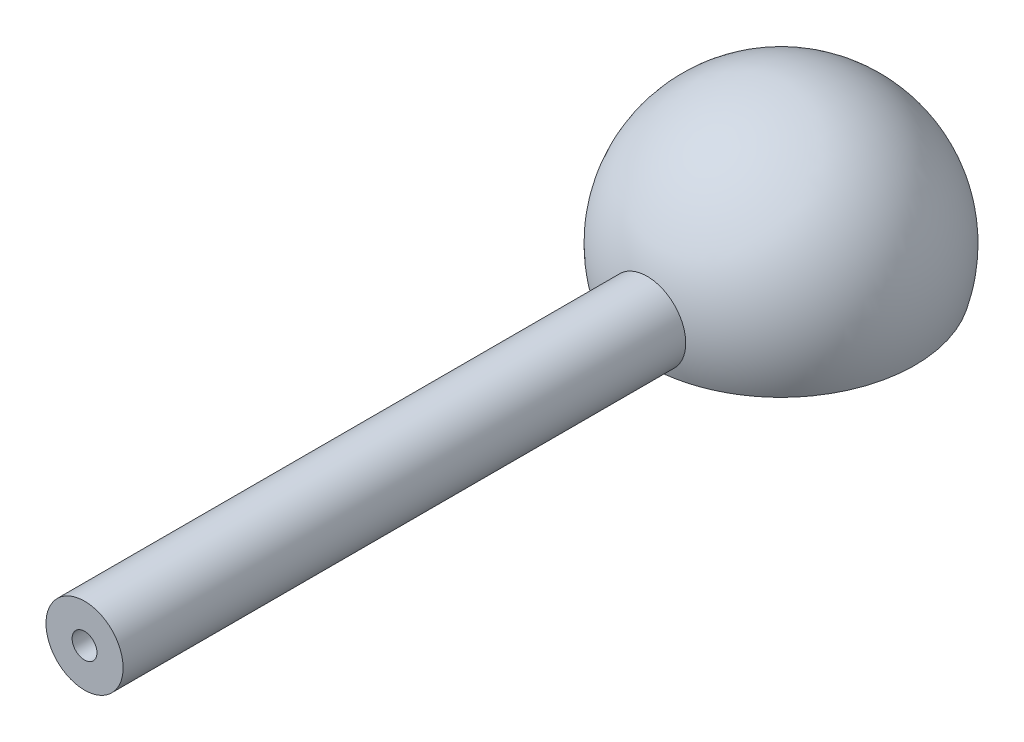
from build123d import *

# Parameters (mm, degrees)
CROQUIS2_R                 = 9
SALIENTE_EXTRUIR1_DEPTH    = 130
CROQUIS4_R                 = 2.9
CORTAR_EXTRUIR1_DEPTH      = 110
CROQUIS8_R                 = 30
CORTAR_EXTRUIR4_DEPTH      = 50
CORTAR_EXTRUIR5_DEPTH      = 50
CORTAR_EXTRUIR5_DEPTH_BACK = 50
CROQUIS9_W                 = 68.768977454
CROQUIS9_H                 = 16.045857594


with BuildPart() as part:
    # Croquis2 → Saliente-Extruir1 (new body)
    with BuildSketch(Plane.XY):
        Circle(CROQUIS2_R)
    extrude(amount=SALIENTE_EXTRUIR1_DEPTH)

    # Croquis4 → Cortar-Extruir1 (cut)
    with BuildSketch(Plane.XY.offset(130)):
        Circle(CROQUIS4_R)
    extrude(amount=-CORTAR_EXTRUIR1_DEPTH, mode=Mode.SUBTRACT)

    # Croquis5 → Revolución1 (revolve)
    with BuildSketch(Plane(origin=(0, 0, 0), x_dir=(1, 0, 0), z_dir=(0, 1, 0))):
        with BuildLine():
            Line((-9, 0), (-9, 1.271007061))
            add(Edge.make_bspline(
                [(0, 65), (-28.23274128, 65), (-32.180679534, 37.044652323), (-36.128617788, 9.089304646), (-9, 1.271007061)],
                knots=[3.141592654, 3.141592654, 3.141592654, 4.572093744, 4.572093744, 6.002594835, 6.002594835, 6.002594835], degree=2, weights=[1, 0.754928956, 1, 0.754928956, 1]))
            Line((0, 65), (0, 0))
            Line((0, 0), (-9, 0))
        make_face()
    revolve(axis=Axis((0, 0, -65), (0, 0, 1)))

    # Croquis6 → Cortar-Revolución7 (revolve, cut)
    with BuildSketch(Plane(origin=(0, 0, 0), x_dir=(1, 0, 0), z_dir=(0, 1, 0))):
        with BuildLine():
            Line((0.378974551, 60.260921696), (0.378974551, 5.260921696))
            ThreePointArc((0.378974551, 5.260921696), (-27.121025449, 32.760921696), (0.378974551, 60.260921696))
        make_face()
    revolve(axis=Axis((0.378974551, 0, -60.260921696), (0, 0, 1)), mode=Mode.SUBTRACT)

    # Croquis8 → Cortar-Extruir4 (cut)
    with BuildSketch(Plane(origin=(0, 0, 0), x_dir=(1, 0, 0), z_dir=(0, 1, 0))):
        with Locations((0, 32.620169224)):
            Circle(CROQUIS8_R)
    extrude(amount=-CORTAR_EXTRUIR4_DEPTH, mode=Mode.SUBTRACT)

    # Croquis9 → Cortar-Extruir5 (cut, two sides: drawn at the far end of the back side and taken through both)
    with BuildSketch(Plane(origin=(0, 0, 0), x_dir=(0, 0, -1), z_dir=(1, 0, 0)).offset(-CORTAR_EXTRUIR5_DEPTH_BACK)):
        with Locations((34.149270006, -17.022928797)):
            Rectangle(CROQUIS9_W, CROQUIS9_H)
    extrude(amount=CORTAR_EXTRUIR5_DEPTH + CORTAR_EXTRUIR5_DEPTH_BACK, mode=Mode.SUBTRACT)


solid = part.part
